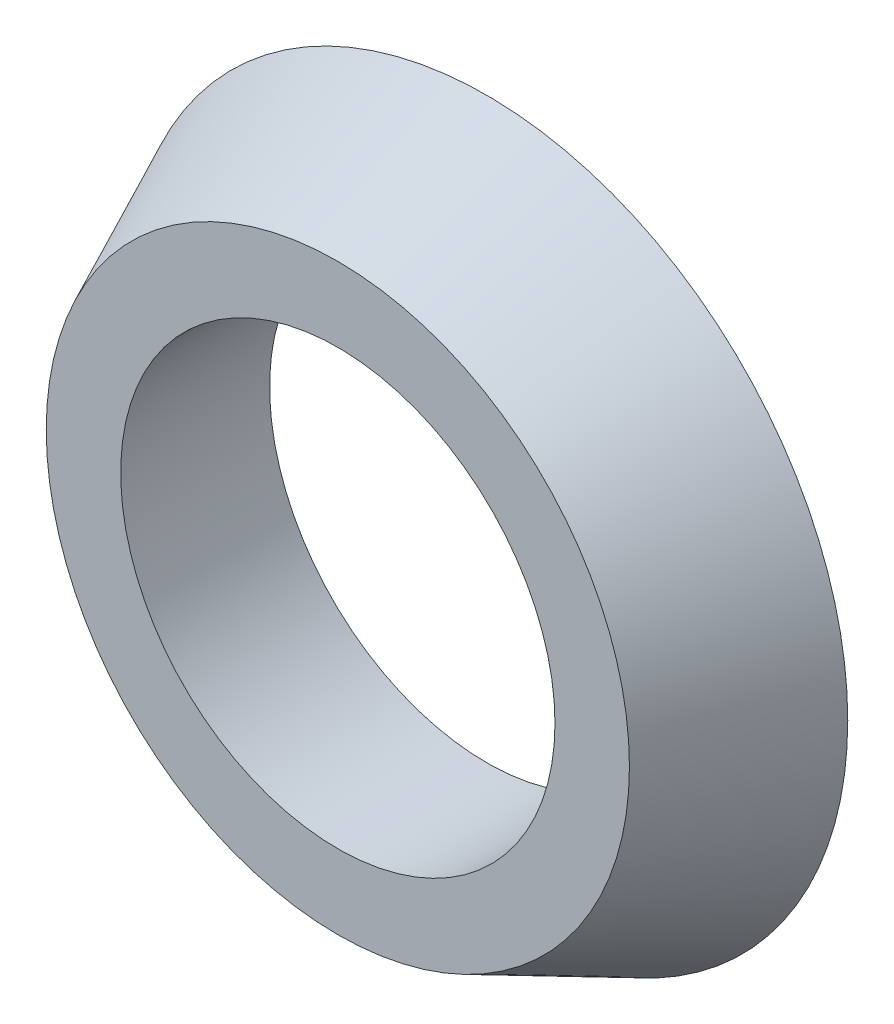
from build123d import *

# Parameters (mm, degrees)
SKETCH1_R           = 23.5
BOSS_EXTRUDE1_DEPTH = 12
BOSS_EXTRUDE1_DRAFT = 25
CUT_EXTRUDE1_REACH  = 44.862
SKETCH2_R           = 17.5


with BuildPart() as part:
    # Sketch1 → Boss-Extrude1 (with draft: the straight prism first)
    with BuildSketch(Plane.XY):
        Circle(SKETCH1_R)
    extrude(amount=-BOSS_EXTRUDE1_DEPTH)
    # Boss-Extrude1: the draft: its side faces are tilted about the plane it starts from
    boss_extrude1_sides = [part.faces().sort_by_distance(p)[0] for p in [
        (-23.5, 0, -6),
    ]]
    draft(boss_extrude1_sides, Plane.XY, BOSS_EXTRUDE1_DRAFT)

    # Sketch2 → Cut-Extrude1 (cut, up to next)
    with BuildSketch(Plane.XY, mode=Mode.PRIVATE) as cut_extrude1_sk1:
        Circle(SKETCH2_R)
    cut_extrude1_tool1 = extrude(cut_extrude1_sk1.sketch, amount=-CUT_EXTRUDE1_REACH, mode=Mode.PRIVATE) & part.part
    add(cut_extrude1_tool1.solids().sort_by_distance((0, 0, 0))[0], mode=Mode.SUBTRACT)


solid = part.part
